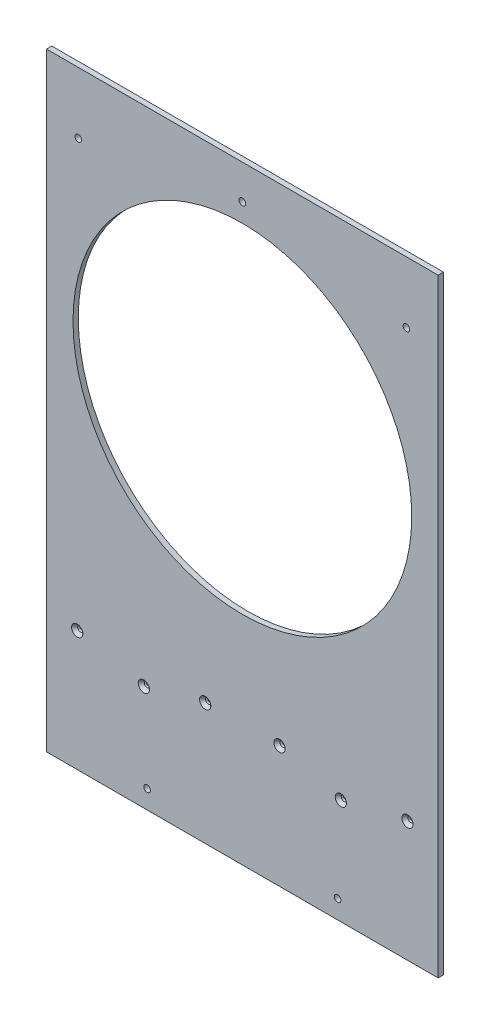
from build123d import *

# Parameters (mm, degrees)
SKETCH1_W                                     = 469.9
SKETCH1_H                                     = 2413
SKETCH1_R                                     = 203.2
BOSS_EXTRUDE1_DEPTH                           = 6.35
CSK_FOR_1_4_FLAT_HEAD_SOCKET_CAP_SCR_2_COUNT  = 2
CSK_FOR_1_4_FLAT_HEAD_SOCKET_CAP_SCR_2_PITCH  = 76.2
CSK_FOR_1_4_FLAT_HEAD_SOCKET_CAP_SCR_3_COUNT  = 2
CSK_FOR_1_4_FLAT_HEAD_SOCKET_CAP_SCR_3_PITCH  = 89.142542345
CSK_FOR_1_4_FLAT_HEAD_SOCKET_CAP_SCR_4_COUNT  = 2
CSK_FOR_1_4_FLAT_HEAD_SOCKET_CAP_SCR_4_PITCH  = 163.936718394
CSK_FOR_1_4_FLAT_HEAD_SOCKET_CAP_SCR_5_COUNT  = 2
CSK_FOR_1_4_FLAT_HEAD_SOCKET_CAP_SCR_5_PITCH  = 711.2
CSK_FOR_1_4_FLAT_HEAD_SOCKET_CAP_SCR_6_COUNT  = 2
CSK_FOR_1_4_FLAT_HEAD_SOCKET_CAP_SCR_6_PITCH  = 695.384275934
CSK_FOR_1_4_FLAT_HEAD_SOCKET_CAP_SCR_7_COUNT  = 2
CSK_FOR_1_4_FLAT_HEAD_SOCKET_CAP_SCR_7_PITCH  = 716.764837904
CSK_FOR_1_4_FLAT_HEAD_SOCKET_CAP_SCR_8_COUNT  = 2
CSK_FOR_1_4_FLAT_HEAD_SOCKET_CAP_SCR_8_PITCH  = 710.371803251
CSK_FOR_1_4_FLAT_HEAD_SOCKET_CAP_SCR_9_COUNT  = 2
CSK_FOR_1_4_FLAT_HEAD_SOCKET_CAP_SCR_9_PITCH  = 1422.4
CSK_FOR_1_4_FLAT_HEAD_SOCKET_CAP_SCR_10_COUNT = 2
CSK_FOR_1_4_FLAT_HEAD_SOCKET_CAP_SCR_10_PITCH = 1404.60778242
CSK_FOR_1_4_FLAT_HEAD_SOCKET_CAP_SCR_11_COUNT = 2
CSK_FOR_1_4_FLAT_HEAD_SOCKET_CAP_SCR_11_PITCH = 1425.190567207
CSK_FOR_1_4_FLAT_HEAD_SOCKET_CAP_SCR_12_COUNT = 2
CSK_FOR_1_4_FLAT_HEAD_SOCKET_CAP_SCR_12_PITCH = 1412.087755797
CSK_FOR_1_4_FLAT_HEAD_SOCKET_CAP_SCR_13_COUNT = 2
CSK_FOR_1_4_FLAT_HEAD_SOCKET_CAP_SCR_13_PITCH = 153.55813077
CSK_FOR_1_4_FLAT_HEAD_SOCKET_CAP_SCR_14_COUNT = 2
CSK_FOR_1_4_FLAT_HEAD_SOCKET_CAP_SCR_14_PITCH = 242.697219812
CSK_FOR_1_4_FLAT_HEAD_SOCKET_CAP_SCR_15_COUNT = 2
CSK_FOR_1_4_FLAT_HEAD_SOCKET_CAP_SCR_15_PITCH = 749.86024568
CSK_FOR_1_4_FLAT_HEAD_SOCKET_CAP_SCR_16_COUNT = 2
CSK_FOR_1_4_FLAT_HEAD_SOCKET_CAP_SCR_16_PITCH = 1441.280581843
CSK_FOR_1_4_FLAT_HEAD_SOCKET_CAP_SCR_17_COUNT = 2
CSK_FOR_1_4_FLAT_HEAD_SOCKET_CAP_SCR_17_PITCH = 1428.974413563
CSK_FOR_1_4_FLAT_HEAD_SOCKET_CAP_SCR_18_COUNT = 2
CSK_FOR_1_4_FLAT_HEAD_SOCKET_CAP_SCR_18_PITCH = 725.925992834
F_5_16_0_3125_DIAMETER_HOLE1_D                = 7.9375
SKETCH6_W                                     = 469.9
SKETCH6_H                                     = 1654.81
CUT_EXTRUDE1_DEPTH                            = 2425.419688297
SKETCH7_W                                     = 469.9
SKETCH7_H                                     = 27.94
CUT_EXTRUDE2_DEPTH                            = 2425.419688297


with BuildPart() as part:
    # Sketch1 → Boss-Extrude1 (new body)
    with BuildSketch(Plane.XY):
        with Locations((0, 1206.5)):
            Rectangle(SKETCH1_W, SKETCH1_H)
        with Locations((0, 695.96)):
            Circle(SKETCH1_R, mode=Mode.SUBTRACT)
        with Locations((0, 1407.16)):
            Circle(SKETCH1_R, mode=Mode.SUBTRACT)
        with Locations((0, 2118.36)):
            Circle(SKETCH1_R, mode=Mode.SUBTRACT)
    extrude(amount=BOSS_EXTRUDE1_DEPTH)

    # Sketch3 → CSK for 1/4 Flat Head Socket Cap Screw1 (revolve, cut)
    with BuildSketch(Plane(origin=(44.571271172, 378.545152647, 6.35), x_dir=(0, -1, 0), z_dir=(1, 0, 0))):
        Polygon((0, 0), (0, 6.35), (3.3782, 6.35), (3.3782, 3.871564875), (6.7437, 0), align=None)
    csk_for_1_4_flat_head_socket_cap_screw1 = revolve(axis=Axis((44.571271172, 378.545152647, 12.7), (0, 0, -1)), mode=Mode.SUBTRACT)

    # CSK for 1_4 Flat Head Socket Cap Scr 2: CSK for 1/4 Flat Head Socket Cap Screw1 ×2
    with Locations(*[Vector(0.9659258262890683, -0.2588190451025208, 0) * (i * CSK_FOR_1_4_FLAT_HEAD_SOCKET_CAP_SCR_2_PITCH) for i in range(1, CSK_FOR_1_4_FLAT_HEAD_SOCKET_CAP_SCR_2_COUNT)]):
        add(csk_for_1_4_flat_head_socket_cap_screw1, mode=Mode.SUBTRACT)

    # CSK for 1_4 Flat Head Socket Cap Scr 3: CSK for 1/4 Flat Head Socket Cap Screw1 ×2
    with Locations(*[(-i * CSK_FOR_1_4_FLAT_HEAD_SOCKET_CAP_SCR_3_PITCH, 0, 0) for i in range(1, CSK_FOR_1_4_FLAT_HEAD_SOCKET_CAP_SCR_3_COUNT)]):
        add(csk_for_1_4_flat_head_socket_cap_screw1, mode=Mode.SUBTRACT)

    # CSK for 1_4 Flat Head Socket Cap Scr 4: CSK for 1/4 Flat Head Socket Cap Screw1 ×2
    with Locations(*[Vector(-0.9927372702249053, -0.12030258644935032, 0) * (i * CSK_FOR_1_4_FLAT_HEAD_SOCKET_CAP_SCR_4_PITCH) for i in range(1, CSK_FOR_1_4_FLAT_HEAD_SOCKET_CAP_SCR_4_COUNT)]):
        add(csk_for_1_4_flat_head_socket_cap_screw1, mode=Mode.SUBTRACT)

    # CSK for 1_4 Flat Head Socket Cap Scr 5: CSK for 1/4 Flat Head Socket Cap Screw1 ×2
    with Locations(*[(0, i * CSK_FOR_1_4_FLAT_HEAD_SOCKET_CAP_SCR_5_PITCH, 0) for i in range(1, CSK_FOR_1_4_FLAT_HEAD_SOCKET_CAP_SCR_5_COUNT)]):
        add(csk_for_1_4_flat_head_socket_cap_screw1, mode=Mode.SUBTRACT)

    # CSK for 1_4 Flat Head Socket Cap Scr 6: CSK for 1/4 Flat Head Socket Cap Screw1 ×2
    with Locations(*[Vector(0.10584586179249755, 0.9943825488922277, 0) * (i * CSK_FOR_1_4_FLAT_HEAD_SOCKET_CAP_SCR_6_PITCH) for i in range(1, CSK_FOR_1_4_FLAT_HEAD_SOCKET_CAP_SCR_6_COUNT)]):
        add(csk_for_1_4_flat_head_socket_cap_screw1, mode=Mode.SUBTRACT)

    # CSK for 1_4 Flat Head Socket Cap Scr 7: CSK for 1/4 Flat Head Socket Cap Screw1 ×2
    with Locations(*[Vector(-0.12436790650262035, 0.9922361734144526, 0) * (i * CSK_FOR_1_4_FLAT_HEAD_SOCKET_CAP_SCR_7_PITCH) for i in range(1, CSK_FOR_1_4_FLAT_HEAD_SOCKET_CAP_SCR_7_COUNT)]):
        add(csk_for_1_4_flat_head_socket_cap_screw1, mode=Mode.SUBTRACT)

    # CSK for 1_4 Flat Head Socket Cap Scr 8: CSK for 1/4 Flat Head Socket Cap Screw1 ×2
    with Locations(*[Vector(-0.22909987356363595, 0.9734029216789553, 0) * (i * CSK_FOR_1_4_FLAT_HEAD_SOCKET_CAP_SCR_8_PITCH) for i in range(1, CSK_FOR_1_4_FLAT_HEAD_SOCKET_CAP_SCR_8_COUNT)]):
        add(csk_for_1_4_flat_head_socket_cap_screw1, mode=Mode.SUBTRACT)

    # CSK for 1_4 Flat Head Socket Cap Scr 9: CSK for 1/4 Flat Head Socket Cap Screw1 ×2
    with Locations(*[(0, i * CSK_FOR_1_4_FLAT_HEAD_SOCKET_CAP_SCR_9_PITCH, 0) for i in range(1, CSK_FOR_1_4_FLAT_HEAD_SOCKET_CAP_SCR_9_COUNT)]):
        add(csk_for_1_4_flat_head_socket_cap_screw1, mode=Mode.SUBTRACT)

    # CSK for 1_4 Flat Head Socket Cap Scr 10: CSK for 1/4 Flat Head Socket Cap Screw1 ×2
    with Locations(*[Vector(0.05240149519635648, 0.9986260978470302, 0) * (i * CSK_FOR_1_4_FLAT_HEAD_SOCKET_CAP_SCR_10_PITCH) for i in range(1, CSK_FOR_1_4_FLAT_HEAD_SOCKET_CAP_SCR_10_COUNT)]):
        add(csk_for_1_4_flat_head_socket_cap_screw1, mode=Mode.SUBTRACT)

    # CSK for 1_4 Flat Head Socket Cap Scr 11: CSK for 1/4 Flat Head Socket Cap Screw1 ×2
    with Locations(*[Vector(-0.06254780546262285, 0.9980419690733501, 0) * (i * CSK_FOR_1_4_FLAT_HEAD_SOCKET_CAP_SCR_11_PITCH) for i in range(1, CSK_FOR_1_4_FLAT_HEAD_SOCKET_CAP_SCR_11_COUNT)]):
        add(csk_for_1_4_flat_head_socket_cap_screw1, mode=Mode.SUBTRACT)

    # CSK for 1_4 Flat Head Socket Cap Scr 12: CSK for 1/4 Flat Head Socket Cap Screw1 ×2
    with Locations(*[Vector(-0.11525210783816901, 0.9933362731919434, 0) * (i * CSK_FOR_1_4_FLAT_HEAD_SOCKET_CAP_SCR_12_PITCH) for i in range(1, CSK_FOR_1_4_FLAT_HEAD_SOCKET_CAP_SCR_12_COUNT)]):
        add(csk_for_1_4_flat_head_socket_cap_screw1, mode=Mode.SUBTRACT)

    # CSK for 1_4 Flat Head Socket Cap Scr 13: CSK for 1/4 Flat Head Socket Cap Screw1 ×2
    with Locations(*[Vector(0.9999387727480229, -0.01106574693266877, 0) * (i * CSK_FOR_1_4_FLAT_HEAD_SOCKET_CAP_SCR_13_PITCH) for i in range(1, CSK_FOR_1_4_FLAT_HEAD_SOCKET_CAP_SCR_13_COUNT)]):
        add(csk_for_1_4_flat_head_socket_cap_screw1, mode=Mode.SUBTRACT)

    # CSK for 1_4 Flat Head Socket Cap Scr 14: CSK for 1/4 Flat Head Socket Cap Screw1 ×2
    with Locations(*[Vector(-0.9999754894630325, -0.007001462216473419, 0) * (i * CSK_FOR_1_4_FLAT_HEAD_SOCKET_CAP_SCR_14_PITCH) for i in range(1, CSK_FOR_1_4_FLAT_HEAD_SOCKET_CAP_SCR_14_COUNT)]):
        add(csk_for_1_4_flat_head_socket_cap_screw1, mode=Mode.SUBTRACT)

    # CSK for 1_4 Flat Head Socket Cap Scr 15: CSK for 1/4 Flat Head Socket Cap Screw1 ×2
    with Locations(*[Vector(-0.3236486699631256, 0.9461773292734824, 0) * (i * CSK_FOR_1_4_FLAT_HEAD_SOCKET_CAP_SCR_15_PITCH) for i in range(1, CSK_FOR_1_4_FLAT_HEAD_SOCKET_CAP_SCR_15_COUNT)]):
        add(csk_for_1_4_flat_head_socket_cap_screw1, mode=Mode.SUBTRACT)

    # CSK for 1_4 Flat Head Socket Cap Scr 16: CSK for 1/4 Flat Head Socket Cap Screw1 ×2
    with Locations(*[Vector(-0.16838586062272745, 0.9857211583111846, 0) * (i * CSK_FOR_1_4_FLAT_HEAD_SOCKET_CAP_SCR_16_PITCH) for i in range(1, CSK_FOR_1_4_FLAT_HEAD_SOCKET_CAP_SCR_16_COUNT)]):
        add(csk_for_1_4_flat_head_socket_cap_screw1, mode=Mode.SUBTRACT)

    # CSK for 1_4 Flat Head Socket Cap Scr 17: CSK for 1/4 Flat Head Socket Cap Screw1 ×2
    with Locations(*[Vector(0.10745379859161856, 0.9942100789914735, 0) * (i * CSK_FOR_1_4_FLAT_HEAD_SOCKET_CAP_SCR_17_PITCH) for i in range(1, CSK_FOR_1_4_FLAT_HEAD_SOCKET_CAP_SCR_17_COUNT)]):
        add(csk_for_1_4_flat_head_socket_cap_screw1, mode=Mode.SUBTRACT)

    # CSK for 1_4 Flat Head Socket Cap Scr 18: CSK for 1/4 Flat Head Socket Cap Screw1 ×2
    with Locations(*[Vector(0.21152118858309418, 0.9773734121513615, 0) * (i * CSK_FOR_1_4_FLAT_HEAD_SOCKET_CAP_SCR_18_PITCH) for i in range(1, CSK_FOR_1_4_FLAT_HEAD_SOCKET_CAP_SCR_18_COUNT)]):
        add(csk_for_1_4_flat_head_socket_cap_screw1, mode=Mode.SUBTRACT)

    # 5/16 (0.3125) Diameter Hole1 (through all)
    with Locations(Plane.XY.offset(6.35)):
        with Locations((-114.3, 254.635), (-114.3, 210.185), (-196.85, 177.8), (196.85, 177.8), (114.3, 210.185), (114.3, 254.635), (-114.3, 965.835), (-114.3, 921.385), (-196.85, 889), (196.85, 889), (114.3, 921.385), (114.3, 965.835), (-114.3, 1677.035), (-114.3, 1632.585), (-196.85, 1600.2), (196.85, 1600.2), (114.3, 1632.585), (114.3, 1677.035), (-196.85, 2311.4), (196.85, 2311.4), (0, 2343.785)):
            Hole(F_5_16_0_3125_DIAMETER_HOLE1_D / 2)

    # Sketch6 → Cut-Extrude1 (cut, through all)
    with BuildSketch(Plane.XY.offset(6.35)):
        with Locations((0, 827.405)):
            Rectangle(SKETCH6_W, SKETCH6_H)
    extrude(amount=-CUT_EXTRUDE1_DEPTH, mode=Mode.SUBTRACT)

    # Sketch7 → Cut-Extrude2 (cut, through all)
    with BuildSketch(Plane.XY.offset(6.35)):
        with Locations((0, 2399.03)):
            Rectangle(SKETCH7_W, SKETCH7_H)
    extrude(amount=-CUT_EXTRUDE2_DEPTH, mode=Mode.SUBTRACT)


solid = part.part
